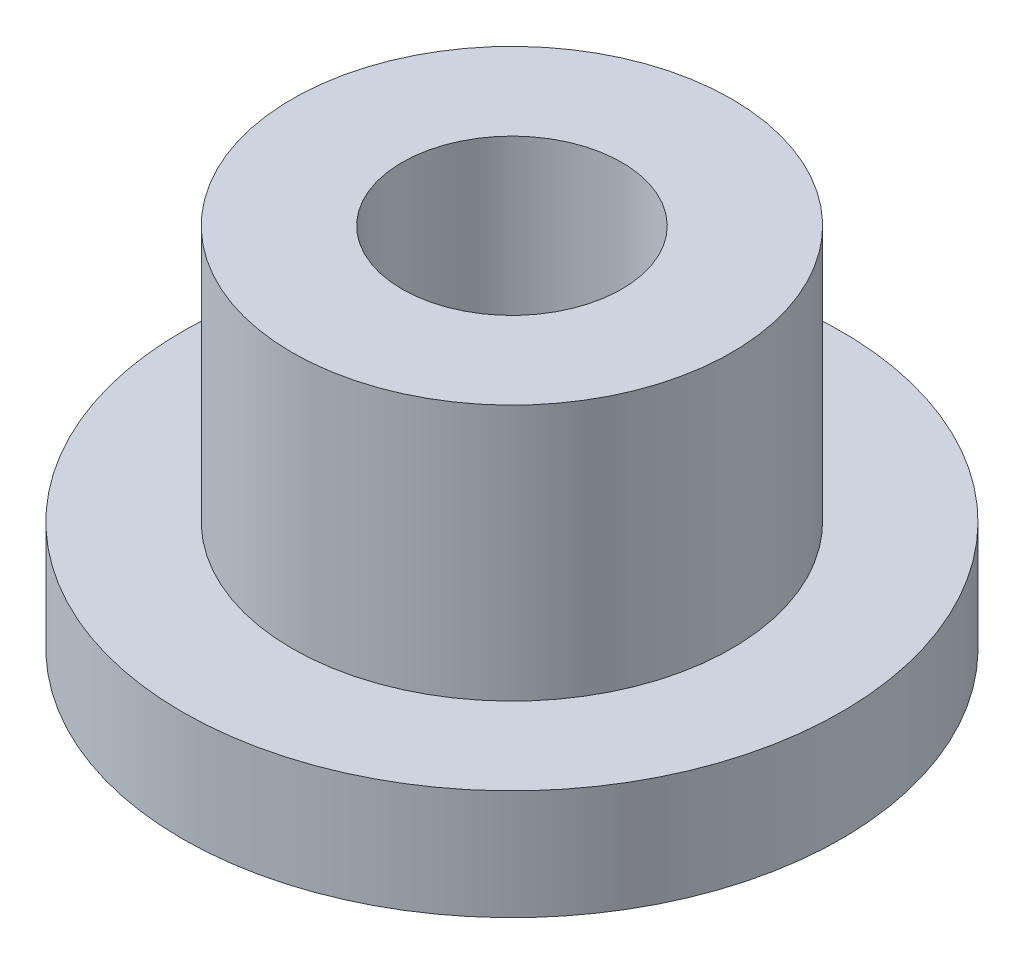
from build123d import *

# Parameters (mm, degrees)
CROQUIS1_R              = 4.5
CROQUIS1_R_2            = 1.5
SALIENTE_EXTRUIR1_DEPTH = 1.5
CROQUIS2_R              = 3
CROQUIS2_R_2            = 1.5
SALIENTE_EXTRUIR2_DEPTH = 3.5


with BuildPart() as part:
    # Croquis1 → Saliente-Extruir1 (new body)
    with BuildSketch(Plane(origin=(0, 0, 0), x_dir=(1, 0, 0), z_dir=(0, 1, 0))):
        with Locations(Location((0, 0, 0), (0, 0, 270))):
            Circle(CROQUIS1_R)
        with Locations(Location((0, 0, 0), (0, 0, 270))):
            Circle(CROQUIS1_R_2, mode=Mode.SUBTRACT)
    extrude(amount=SALIENTE_EXTRUIR1_DEPTH)

    # Croquis2 → Saliente-Extruir2 (add)
    with BuildSketch(Plane(origin=(0, 1.5, 0), x_dir=(1, 0, 0), z_dir=(0, 1, 0))):
        with Locations(Location((0, 0, 0), (0, 0, 270))):
            Circle(CROQUIS2_R)
        with Locations(Location((0, 0, 0), (0, 0, 270))):
            Circle(CROQUIS2_R_2, mode=Mode.SUBTRACT)
    extrude(amount=SALIENTE_EXTRUIR2_DEPTH)


solid = part.part
